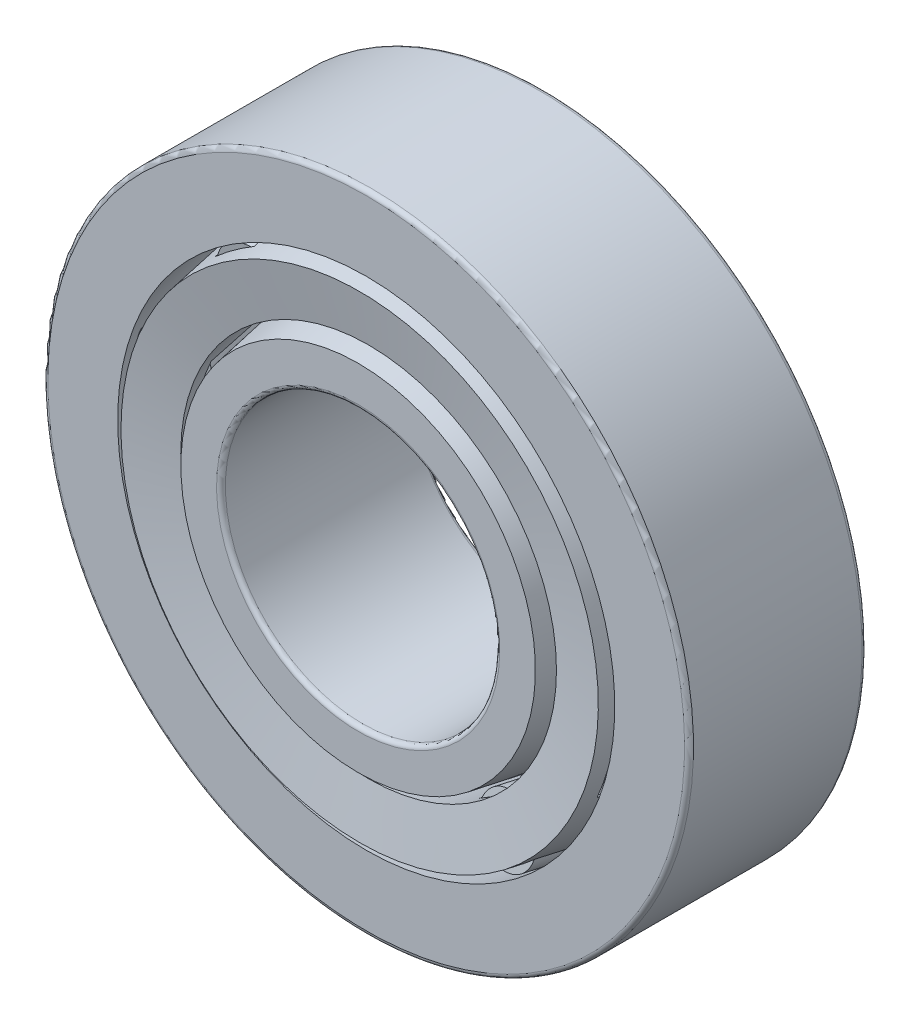
from build123d import *

# Parameters (mm, degrees)
CIRPATTERN1_COUNT = 10
CIRPATTERN2_COUNT = 10
CIRPATTERN2_ANGLE = 324
FILLET1_R         = 0.275
FILLET2_R         = 0.275


with BuildPart() as part:
    # Sketch1 → Revolve1 (revolve)
    with BuildSketch(Plane(origin=(0, 0, 0), x_dir=(0, 0, -1), z_dir=(1, 0, 0)), mode=Mode.PRIVATE) as revolve1_sk:
        Polygon((-5.5, 20), (5.5, 20), (5.5, 17.339596788), (-5.5, 15.4), align=None)
    revolve(revolve1_sk.sketch.rotate(Axis((0, 0, 6), (0, 0, -1)), 180), axis=Axis((0, 0, 6), (0, 0, -1)))

    # Fillet1
    fillet1_edges = [part.edges().sort_by_distance(p)[0] for p in [
        (0, 20, -5.5),
        (0, 20, 5.5),
    ]]
    fillet(fillet1_edges, radius=FILLET1_R)


with BuildPart() as body_2:
    # Sketch5 → Revolve4 (revolve)
    with BuildSketch(Plane(origin=(0, 0, 0), x_dir=(0, 0, -1), z_dir=(1, 0, 0)), mode=Mode.PRIVATE) as revolve4_sk:
        Polygon((6, 13.1), (-6, 10.984076231), (-6, 8.5), (6, 8.5), align=None)
    revolve(revolve4_sk.sketch.rotate(Axis((0, 0, 6), (0, 0, -1)), 180), axis=Axis((0, 0, 6), (0, 0, -1)))

    # Fillet2
    fillet2_edges = [body_2.edges().sort_by_distance(p)[0] for p in [
        (0, 8.5, 6),
        (0, 8.5, -6),
    ]]
    fillet(fillet2_edges, radius=FILLET2_R)


with BuildPart() as body_3:
    # Sketch2 → Revolve2 (revolve)
    with BuildSketch(Plane(origin=(0, 0, 0), x_dir=(0, 0, -1), z_dir=(1, 0, 0)), mode=Mode.PRIVATE) as revolve2_sk:
        Polygon((-5.907488676, 14.787178717), (-5.352420729, 11.639231964), (5.5, 13.552806544), (7.157488676, 13.845066518), (6.602420729, 16.993013272), (5.5, 16.798626753), align=None)
    revolve(revolve2_sk.sketch.rotate(Axis((0, 0, 6), (0, 0, -1)), 180), axis=Axis((0, 0, 6), (0, 0, -1)))

    # Sketch3 → Cut-Revolve1 (revolve, cut)
    with BuildSketch(Plane(origin=(0, 0, 0), x_dir=(0, 0, -1), z_dir=(1, 0, 0))):
        Polygon((-5, 15.48816349), (-4.629954702, 13.389532321), (5.5, 15.175716649), (5.129954702, 17.274347818), align=None)
    cut_revolve1 = revolve(axis=Axis((0, 13.213205341, 5.629954702), (0, 0.17364817766692806, -0.9848077530122085)), mode=Mode.SUBTRACT)

    # CirPattern1: Cut-Revolve1 ×10 about axis
    cirpattern1_axis = Axis((0, 0, 0), (0, 0, 1))
    for i in range(1, CIRPATTERN1_COUNT):
        add(cut_revolve1.rotate(cirpattern1_axis, i * 360 / CIRPATTERN1_COUNT), mode=Mode.SUBTRACT)


with BuildPart() as body_4:
    # Sketch4 → Revolve3 (revolve)
    with BuildSketch(Plane(origin=(0, 0, 0), x_dir=(0, 0, -1), z_dir=(1, 0, 0)), mode=Mode.PRIVATE) as revolve3_sk:
        Polygon((-4.977946681, 15.363092906), (5.152008021, 17.149277233), (5.5, 15.175716649), (-4.629954702, 13.389532321), align=None)
    revolve(revolve3_sk.sketch.rotate(Axis((0, 13.213205341, 5.629954702), (0, 0.17364817766692806, -0.9848077530122085)), 180), axis=Axis((0, 13.213205341, 5.629954702), (0, 0.17364817766692806, -0.9848077530122085)))


with BuildPart() as cirpattern2_1:
    # CirPattern2: pattern copy
    add(body_4.part.rotate(Axis((0, 0, -6), (0, 0, 1)), 1 * CIRPATTERN2_ANGLE / (CIRPATTERN2_COUNT - 1)))


with BuildPart() as cirpattern2_2:
    # CirPattern2: pattern copy
    add(body_4.part.rotate(Axis((0, 0, -6), (0, 0, 1)), 2 * CIRPATTERN2_ANGLE / (CIRPATTERN2_COUNT - 1)))


with BuildPart() as cirpattern2_3:
    # CirPattern2: pattern copy
    add(body_4.part.rotate(Axis((0, 0, -6), (0, 0, 1)), 3 * CIRPATTERN2_ANGLE / (CIRPATTERN2_COUNT - 1)))


with BuildPart() as cirpattern2_4:
    # CirPattern2: pattern copy
    add(body_4.part.rotate(Axis((0, 0, -6), (0, 0, 1)), 4 * CIRPATTERN2_ANGLE / (CIRPATTERN2_COUNT - 1)))


with BuildPart() as cirpattern2_5:
    # CirPattern2: pattern copy
    add(body_4.part.rotate(Axis((0, 0, -6), (0, 0, 1)), 5 * CIRPATTERN2_ANGLE / (CIRPATTERN2_COUNT - 1)))


with BuildPart() as cirpattern2_6:
    # CirPattern2: pattern copy
    add(body_4.part.rotate(Axis((0, 0, -6), (0, 0, 1)), 6 * CIRPATTERN2_ANGLE / (CIRPATTERN2_COUNT - 1)))


with BuildPart() as cirpattern2_7:
    # CirPattern2: pattern copy
    add(body_4.part.rotate(Axis((0, 0, -6), (0, 0, 1)), 7 * CIRPATTERN2_ANGLE / (CIRPATTERN2_COUNT - 1)))


with BuildPart() as cirpattern2_8:
    # CirPattern2: pattern copy
    add(body_4.part.rotate(Axis((0, 0, -6), (0, 0, 1)), 8 * CIRPATTERN2_ANGLE / (CIRPATTERN2_COUNT - 1)))


with BuildPart() as cirpattern2_9:
    # CirPattern2: pattern copy
    add(body_4.part.rotate(Axis((0, 0, -6), (0, 0, 1)), 9 * CIRPATTERN2_ANGLE / (CIRPATTERN2_COUNT - 1)))


solid = Compound([part.part, body_2.part, body_3.part, body_4.part, cirpattern2_1.part, cirpattern2_2.part, cirpattern2_3.part, cirpattern2_4.part, cirpattern2_5.part, cirpattern2_6.part, cirpattern2_7.part, cirpattern2_8.part, cirpattern2_9.part])
